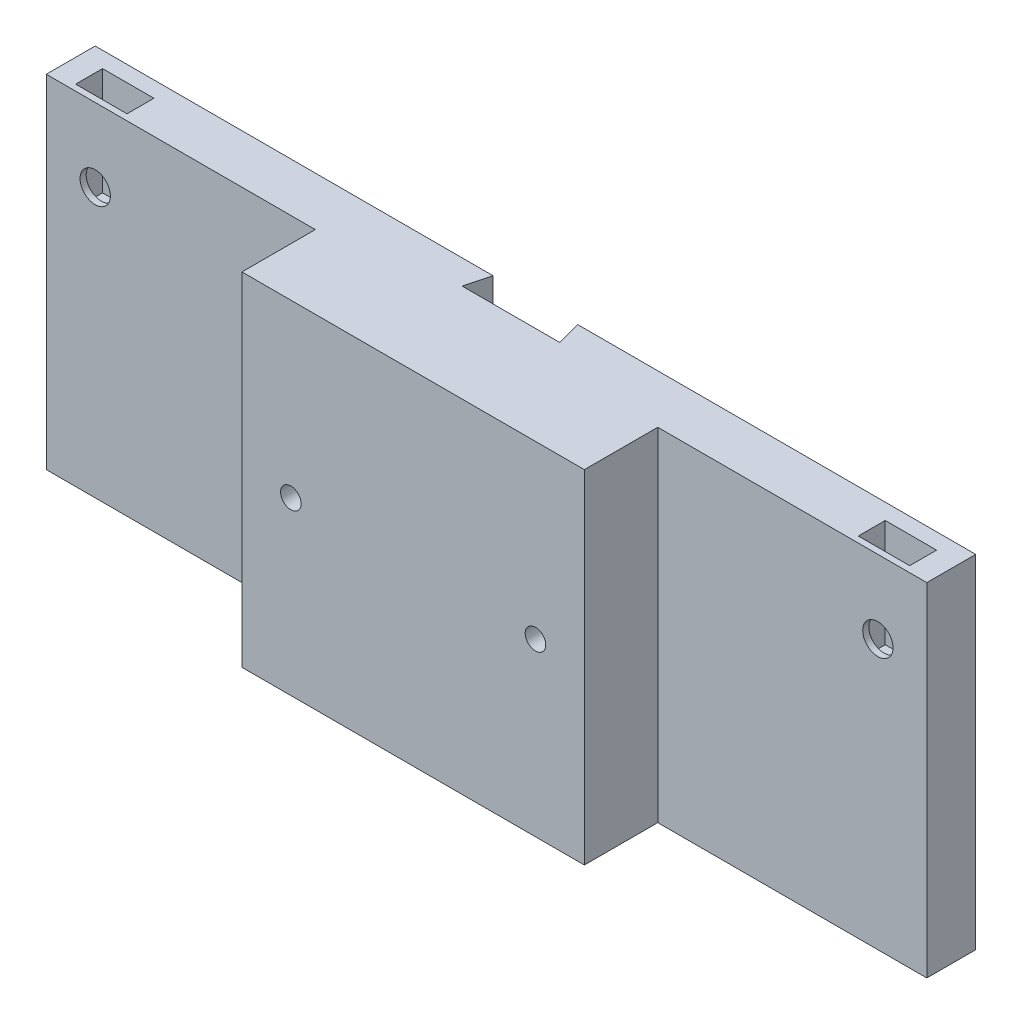
from build123d import *

# Parameters (mm, degrees)
SKIZZE1_W                       = 180
SKIZZE1_H                       = 70
SKIZZE1_R                       = 2.1
SKIZZE1_R_2                     = 3.1
AUFSATZ_LINEAR_AUSTRAGEN2_DEPTH = 25
SKIZZE4_W                       = 55
SKIZZE4_H                       = 70
SCHNITT_LINEAR_AUSTRAGEN1_DEPTH = 15
SKIZZE5_W                       = 10.5
SKIZZE5_H                       = 5.5
SCHNITT_LINEAR_AUSTRAGEN2_DEPTH = 22
SKIZZE6_R                       = 6
SCHNITT_LINEAR_AUSTRAGEN3_DEPTH = 2.3
SCHNITT_LINEAR_AUSTRAGEN4_DEPTH = 60


with BuildPart() as part:
    # Skizze1 → Aufsatz-Linear austragen2 (new body)
    with BuildSketch(Plane.XY):
        Rectangle(SKIZZE1_W, SKIZZE1_H)
        with Locations((25, 0)):
            Circle(SKIZZE1_R, mode=Mode.SUBTRACT)
        with Locations(Location((-25, 0, 0), (0, 0, 180))):
            Circle(SKIZZE1_R, mode=Mode.SUBTRACT)
        with Locations((80, 20)):
            Circle(SKIZZE1_R_2, mode=Mode.SUBTRACT)
        with Locations(Location((-80, 20, 0), (0, 0, 180))):
            Circle(SKIZZE1_R_2, mode=Mode.SUBTRACT)
    extrude(amount=AUFSATZ_LINEAR_AUSTRAGEN2_DEPTH)

    # Skizze4 → Schnitt-Linear austragen1 (cut)
    with BuildSketch(Plane.XY.offset(25)):
        with Locations((62.5, 0)):
            Rectangle(SKIZZE4_W, SKIZZE4_H)
        with Locations((-62.5, 0)):
            Rectangle(SKIZZE4_W, SKIZZE4_H)
    extrude(amount=-SCHNITT_LINEAR_AUSTRAGEN1_DEPTH, mode=Mode.SUBTRACT)

    # Skizze5 → Schnitt-Linear austragen2 (cut)
    with BuildSketch(Plane(origin=(0, 35, 0), x_dir=(1, 0, 0), z_dir=(0, 1, 0))):
        with Locations((80, -6)):
            Rectangle(SKIZZE5_W, SKIZZE5_H)
        with Locations((-80, -6)):
            Rectangle(SKIZZE5_W, SKIZZE5_H)
    extrude(amount=-SCHNITT_LINEAR_AUSTRAGEN2_DEPTH, mode=Mode.SUBTRACT)

    # Skizze6 → Schnitt-Linear austragen3 (cut)
    with BuildSketch(Plane(origin=(0, 0, 0), x_dir=(-1, 0, 0), z_dir=(0, 0, -1))):
        with Locations((-80, 20)):
            Circle(SKIZZE6_R)
        with Locations(Location((80, 20, 0), (0, 0, 180))):
            Circle(SKIZZE6_R)
    extrude(amount=-SCHNITT_LINEAR_AUSTRAGEN3_DEPTH, mode=Mode.SUBTRACT)

    # Skizze7 → Schnitt-Linear austragen4 (cut)
    with BuildSketch(Plane(origin=(0, 35, 0), x_dir=(1, 0, 0), z_dir=(0, 1, 0))):
        Polygon((8.660254038, 0), (-8.660254038, 0), (-10, -5), (10, -5), align=None)
    extrude(amount=-SCHNITT_LINEAR_AUSTRAGEN4_DEPTH, mode=Mode.SUBTRACT)


solid = part.part
